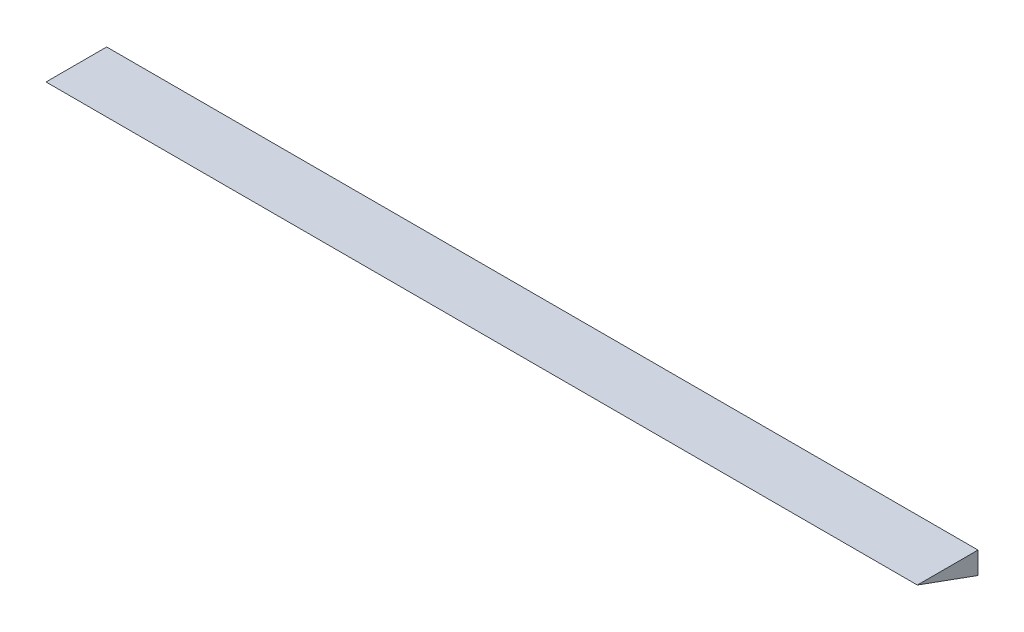
from build123d import *

# Parameters (mm, degrees)
EXTRUDE_1_DEPTH = 108


with BuildPart() as part:
    # 草图1 → 凸台-拉伸1 (new body)
    with BuildSketch(Plane(origin=(0, 0, 0), x_dir=(0, 0, -1), z_dir=(1, 0, 0))):
        Polygon((0, 0), (7.517540966, -2.736161147), (7.517540966, 0), align=None)
    extrude(amount=EXTRUDE_1_DEPTH)


solid = part.part
